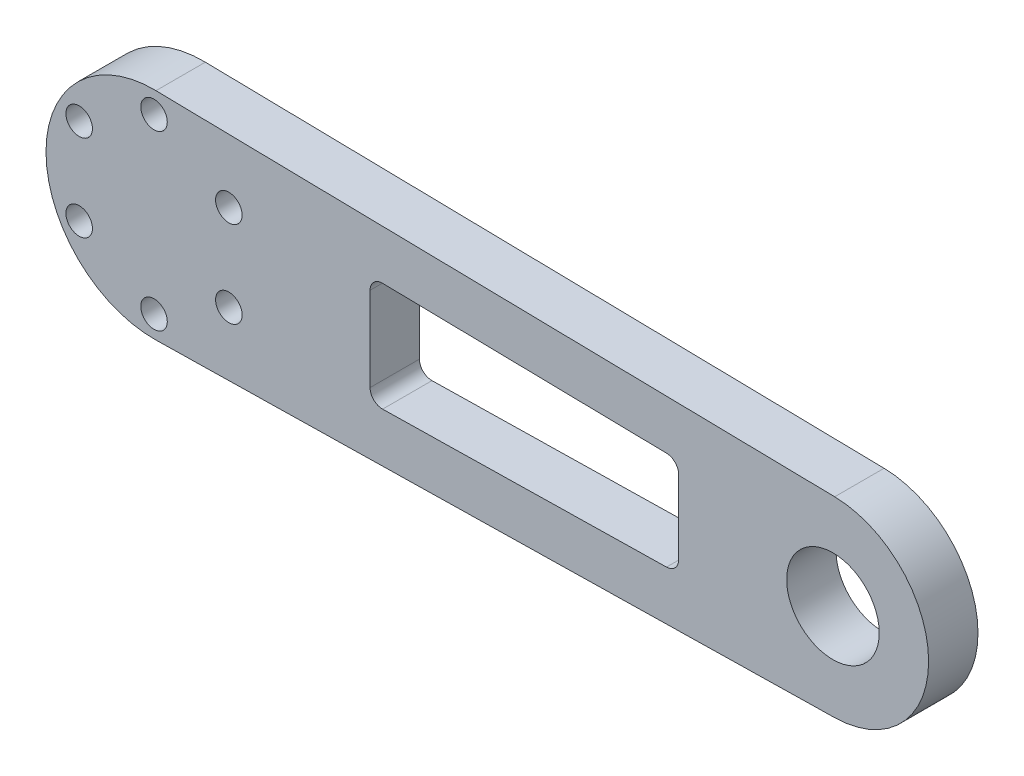
from build123d import *

# Parameters (mm, degrees)
SKETCH1_R                = 7.5
BOSS_EXTRUDE1_DEPTH      = 8
M4_CLEARANCE_HOLE1_D     = 4.3
M4_CLEARANCE_HOLE1_DEPTH = 25
M4_CLEARANCE_HOLE1_TIP   = 1.291850331


with BuildPart() as part:
    # Sketch1 → Boss-Extrude1 (new body)
    with BuildSketch(Plane.XY):
        with BuildLine():
            Line((0.318181818, 17.497107199), (110.281818182, 15.497437805))
            ThreePointArc((110.281818182, 15.497437805), (125.5, 0), (110.281818182, -15.497437805))
            Line((110.281818182, -15.497437805), (0.318181818, -17.497107199))
            ThreePointArc((0.318181818, -17.497107199), (-17.5, 0), (0.318181818, 17.497107199))
        make_face()
        with Locations((110, 0)):
            Circle(SKETCH1_R, mode=Mode.SUBTRACT)
        with BuildLine():
            Line((35, 6.828401482), (35, -6.828401482))
            ThreePointArc((35, -6.828401482), (35.598701901, -8.255413618), (37.036363636, -8.828070876))
            Line((37.036363636, -8.828070876), (83.036363636, -7.991568964))
            ThreePointArc((83.036363636, -7.991568964), (84.427012136, -7.393197669), (85, -5.991899569))
            Line((85, -5.991899569), (85, 5.991899569))
            ThreePointArc((85, 5.991899569), (84.427012136, 7.393197669), (83.036363636, 7.991568964))
            Line((83.036363636, 7.991568964), (37.036363636, 8.828070876))
            ThreePointArc((37.036363636, 8.828070876), (35.598701901, 8.255413618), (35, 6.828401482))
        make_face(mode=Mode.SUBTRACT)
    extrude(amount=BOSS_EXTRUDE1_DEPTH)

    # M4 Clearance Hole1
    with Locations(Plane.XY.offset(8)):
        with Locations((12.124355653, 7), (0, 14), (-12.124355653, 7), (-12.124355653, -7), (0, -14), (12.124355653, -7)):
            Hole(M4_CLEARANCE_HOLE1_D / 2, depth=M4_CLEARANCE_HOLE1_DEPTH)
            with Locations((0, 0, -(M4_CLEARANCE_HOLE1_DEPTH + M4_CLEARANCE_HOLE1_TIP / 2))):  # 118° drill point
                Cone(0, M4_CLEARANCE_HOLE1_D / 2, M4_CLEARANCE_HOLE1_TIP, mode=Mode.SUBTRACT)


solid = part.part
